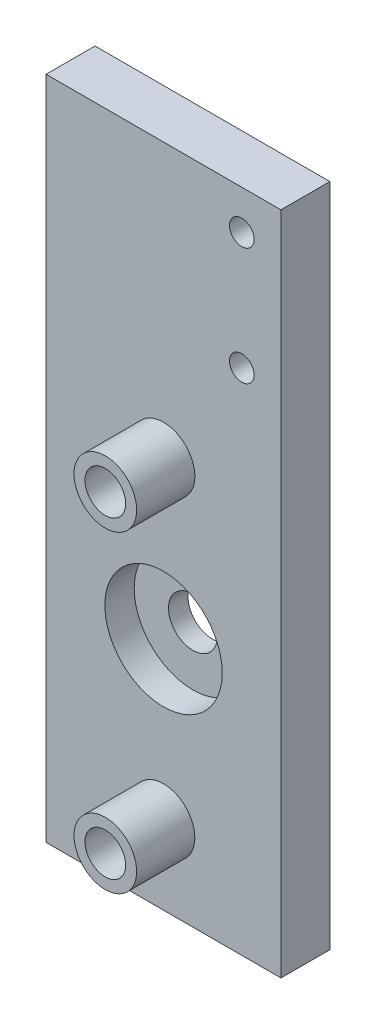
from build123d import *

# Parameters (mm, degrees)
SKETCH1_W           = 38.1
SKETCH1_H           = 76.2
BOSS_EXTRUDE1_DEPTH = 7.9375
SKETCH2_R           = 3.96875
CUT_EXTRUDE1_DEPTH  = 44.330317403
SKETCH4_R           = 9.525
CUT_EXTRUDE2_DEPTH  = 4.7625
SKETCH5_R           = 5.08
BOSS_EXTRUDE2_DEPTH = 9.4488
SKETCH6_R           = 3.302
CUT_EXTRUDE3_DEPTH  = 47.008650575
SKETCH7_W           = 38.1
SKETCH7_H           = 31.75
SKETCH7_R           = 2
BOSS_EXTRUDE4_DEPTH = 7.9375


with BuildPart() as part:
    # Sketch1 → Boss-Extrude1 (new body)
    with BuildSketch(Plane.XY):
        Rectangle(SKETCH1_W, SKETCH1_H)
    extrude(amount=BOSS_EXTRUDE1_DEPTH)

    # Sketch2 → Cut-Extrude1 (cut, through all)
    with BuildSketch(Plane.XY.offset(7.9375)):
        Circle(SKETCH2_R)
    extrude(amount=-CUT_EXTRUDE1_DEPTH, mode=Mode.SUBTRACT)

    # Sketch4 → Cut-Extrude2 (cut)
    with BuildSketch(Plane.XY.offset(7.9375)):
        Circle(SKETCH4_R)
    extrude(amount=-CUT_EXTRUDE2_DEPTH, mode=Mode.SUBTRACT)

    # Sketch5 → Boss-Extrude2 (add)
    with BuildSketch(Plane.XY.offset(7.9375)):
        with Locations(Location((0, 25.4, 0), (0, 0, 180))):
            Circle(SKETCH5_R)
    boss_extrude2 = extrude(amount=BOSS_EXTRUDE2_DEPTH)

    # Sketch6 → Cut-Extrude3 (cut, through all)
    with BuildSketch(Plane.XY.offset(17.3863)):
        with Locations((0, 25.4)):
            Circle(SKETCH6_R)
    cut_extrude3 = extrude(amount=-CUT_EXTRUDE3_DEPTH, mode=Mode.SUBTRACT)

    # Mirror1: Boss-Extrude2, Cut-Extrude3 across plane
    add(boss_extrude2.mirror(Plane.ZX))
    add(cut_extrude3.mirror(Plane.ZX), mode=Mode.SUBTRACT)

    # Sketch7 → Boss-Extrude4 (add)
    with BuildSketch(Plane.XY.offset(7.9375)):
        with Locations((0, 53.975)):
            Rectangle(SKETCH7_W, SKETCH7_H)
        with Locations((12.7, 63.5)):
            Circle(SKETCH7_R, mode=Mode.SUBTRACT)
        with Locations(Location((12.7, 44.45, 0), (0, 0, 180))):
            Circle(SKETCH7_R, mode=Mode.SUBTRACT)
    extrude(amount=-BOSS_EXTRUDE4_DEPTH)


solid = part.part
